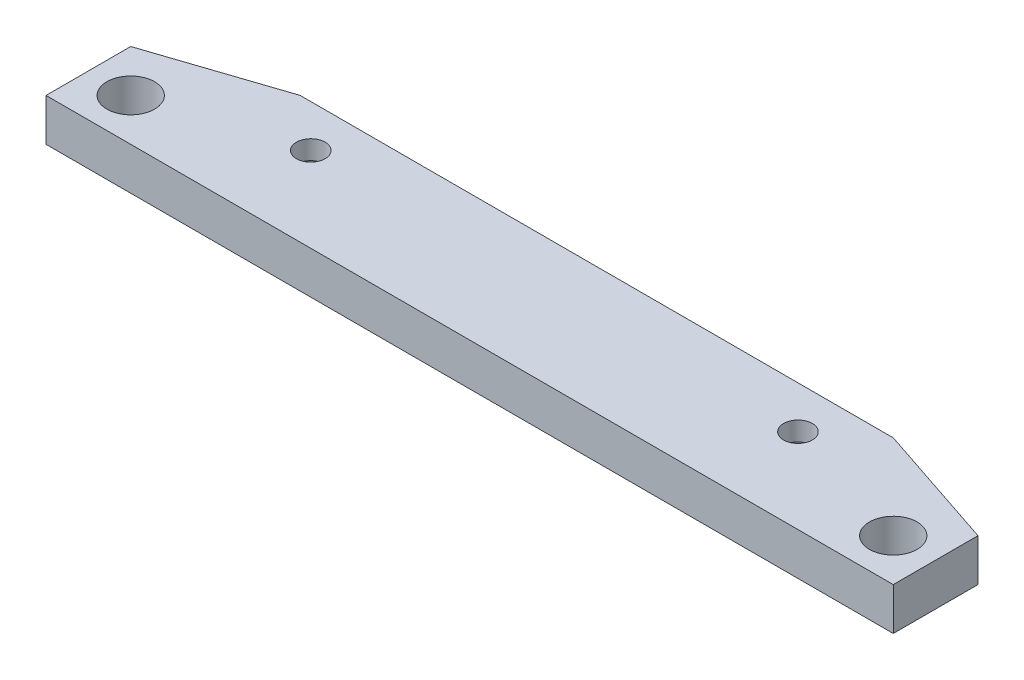
from build123d import *

# Parameters (mm, degrees)
BOSS_EXTRUDE1_DEPTH                            = 6.35
F_1_4_CLEARANCE_HOLE2_D                        = 7.14248
CBORE_FOR_6_SOCKET_HEAD_CAP_SCREW1_D           = 4.3053
CBORE_FOR_6_SOCKET_HEAD_CAP_SCREW1_CBORE_D     = 7.14502
CBORE_FOR_6_SOCKET_HEAD_CAP_SCREW1_CBORE_DEPTH = 3.5052


with BuildPart() as part:
    # Sketch1 → Boss-Extrude1 (new body)
    with BuildSketch(Plane(origin=(0, 0, 0), x_dir=(1, 0, 0), z_dir=(0, 1, 0))):
        Polygon((0, 12.7), (88.9, 12.7), (107.95, 6.35), (107.95, -6.35), (-19.05, -6.35), (-19.05, 6.35), align=None)
    extrude(amount=BOSS_EXTRUDE1_DEPTH)

    # 1/4 Clearance Hole2 (through all)
    with Locations(Plane(origin=(0, 0, 0), x_dir=(-1, 0, 0), z_dir=(0, -1, 0))):
        with Locations((-101.6, 0), (12.7, 0)):
            Hole(F_1_4_CLEARANCE_HOLE2_D / 2)

    # CBORE for #6 Socket Head Cap Screw1 (through all)
    with Locations(Plane(origin=(0, 0, 0), x_dir=(-1, 0, 0), z_dir=(0, -1, 0))):
        with Locations((-80.9625, 6.35), (-7.9375, 6.35)):
            CounterBoreHole(CBORE_FOR_6_SOCKET_HEAD_CAP_SCREW1_D / 2, CBORE_FOR_6_SOCKET_HEAD_CAP_SCREW1_CBORE_D / 2, CBORE_FOR_6_SOCKET_HEAD_CAP_SCREW1_CBORE_DEPTH)


solid = part.part
